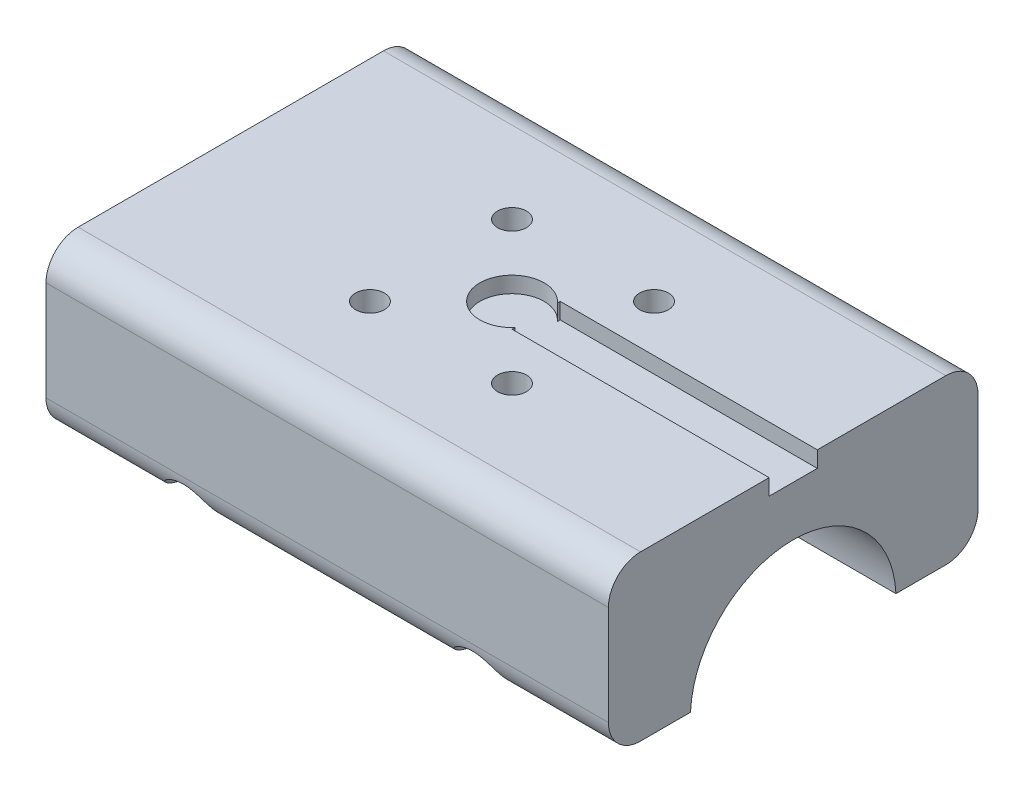
from build123d import *

# Parameters (mm, degrees)
BOSS_EXTRUDE1_DEPTH     = 35
CUT_EXTRUDE1_DEPTH      = 47.8508271
CUT_EXTRUDE1_DEPTH_BACK = 47.8508271
SKETCH2_R               = 12.8
SKETCH3_R               = 2
CUT_EXTRUDE2_DEPTH      = 7.5
SKETCH4_R               = 3.75
CUT_EXTRUDE3_DEPTH      = 16.5
SKETCH5_R               = 1.8
CUT_EXTRUDE4_DEPTH      = 22
SKETCH6_R               = 4
CUT_EXTRUDE5_DEPTH      = 2
SKETCH7_W               = 32
SKETCH7_H               = 6
CUT_EXTRUDE6_DEPTH      = 2
CUT_EXTRUDE7_DEPTH      = 47.850827224
CUT_EXTRUDE7_DEPTH_BACK = 47.850827224
SKETCH8_R               = 1.8
SKETCH9_R               = 3.75
CUT_EXTRUDE8_DEPTH      = 5
CUT_EXTRUDE9_DEPTH      = 8


with BuildPart() as part:
    # Sketch1 → Boss-Extrude1 (new, symmetric)
    with BuildSketch(Plane(origin=(0, 0, 0), x_dir=(0, 0, -1), z_dir=(1, 0, 0))):
        with BuildLine():
            Line((-19, 0.6), (19, 0.6))
            ThreePointArc((19, 0.6), (21.828427125, 1.771572875), (23, 4.6))
            Line((23, 4.6), (23, 17))
            ThreePointArc((23, 17), (21.828427125, 19.828427125), (19, 21))
            Line((19, 21), (-19, 21))
            ThreePointArc((-19, 21), (-21.828427125, 19.828427125), (-23, 17))
            Line((-23, 17), (-23, 4.6))
            ThreePointArc((-23, 4.6), (-21.828427125, 1.771572875), (-19, 0.6))
        make_face()
    extrude(amount=BOSS_EXTRUDE1_DEPTH, both=True)

    # Sketch2 → Cut-Extrude1 (cut, two sides: drawn at the far end of the back side and taken through both)
    with BuildSketch(Plane(origin=(0, 0, 0), x_dir=(0, 0, -1), z_dir=(1, 0, 0)).offset(-CUT_EXTRUDE1_DEPTH_BACK)):
        Circle(SKETCH2_R)
    extrude(amount=CUT_EXTRUDE1_DEPTH + CUT_EXTRUDE1_DEPTH_BACK, mode=Mode.SUBTRACT)

    # Sketch3 → Cut-Extrude2 (cut)
    with BuildSketch(Plane(origin=(0, 0.6, 0), x_dir=(1, 0, 0), z_dir=(0, 1, 0))):
        with Locations(Location((28, -17.5, 0), (0, 0, 228.590377891))):
            Circle(SKETCH3_R)
        with Locations(Location((28, 17.5, 0), (0, 0, 48.590377891))):
            Circle(SKETCH3_R)
        with Locations(Location((-28, -17.5, 0), (0, 0, 228.590377891))):
            Circle(SKETCH3_R)
        with Locations(Location((-28, 17.5, 0), (0, 0, 48.590377891))):
            Circle(SKETCH3_R)
    extrude(amount=CUT_EXTRUDE2_DEPTH, mode=Mode.SUBTRACT)

    # Sketch4 → Cut-Extrude3 (cut)
    with BuildSketch(Plane(origin=(0, 0, 0), x_dir=(1, 0, 0), z_dir=(0, 1, 0))):
        with Locations(Location((8.84, -8.84, 0), (0, 0, 90))):
            Circle(SKETCH4_R)
        with Locations(Location((8.84, 8.84, 0), (0, 0, 90))):
            Circle(SKETCH4_R)
        with Locations(Location((-8.84, -8.84, 0), (0, 0, 90))):
            Circle(SKETCH4_R)
        with Locations(Location((-8.84, 8.84, 0), (0, 0, 90))):
            Circle(SKETCH4_R)
    extrude(amount=CUT_EXTRUDE3_DEPTH, mode=Mode.SUBTRACT)

    # Sketch5 → Cut-Extrude4 (cut)
    with BuildSketch(Plane(origin=(0, 0, 0), x_dir=(1, 0, 0), z_dir=(0, 1, 0))):
        with Locations(Location((8.84, -8.84, 0), (0, 0, 90))):
            Circle(SKETCH5_R)
        with Locations(Location((8.84, 8.84, 0), (0, 0, 90))):
            Circle(SKETCH5_R)
        with Locations(Location((-8.84, -8.84, 0), (0, 0, 90))):
            Circle(SKETCH5_R)
        with Locations(Location((-8.84, 8.84, 0), (0, 0, 90))):
            Circle(SKETCH5_R)
    extrude(amount=CUT_EXTRUDE4_DEPTH, mode=Mode.SUBTRACT)

    # Sketch6 → Cut-Extrude5 (cut)
    with BuildSketch(Plane(origin=(0, 21, 0), x_dir=(1, 0, 0), z_dir=(0, 1, 0))):
        with Locations(Location((0, 0, 0), (0, 0, 270))):
            Circle(SKETCH6_R)
    extrude(amount=-CUT_EXTRUDE5_DEPTH, mode=Mode.SUBTRACT)

    # Sketch7 → Cut-Extrude6 (cut)
    with BuildSketch(Plane(origin=(0, 21, 0), x_dir=(1, 0, 0), z_dir=(0, 1, 0))):
        with Locations((19, 0)):
            Rectangle(SKETCH7_W, SKETCH7_H)
    extrude(amount=-CUT_EXTRUDE6_DEPTH, mode=Mode.SUBTRACT)

    # Sketch8 → Cut-Extrude7 (cut, two sides: drawn at the far end of the back side and taken through both)
    with BuildSketch(Plane.XY.offset(-CUT_EXTRUDE7_DEPTH_BACK)):
        with Locations((18, 0)):
            Circle(SKETCH8_R)
        with Locations((-18, 0)):
            Circle(SKETCH8_R)
    extrude(amount=CUT_EXTRUDE7_DEPTH + CUT_EXTRUDE7_DEPTH_BACK, mode=Mode.SUBTRACT)

    # Sketch9 → Cut-Extrude8 (cut)
    with BuildSketch(Plane.XY.offset(23)):
        with Locations((18, 0)):
            Circle(SKETCH9_R)
        with Locations((-18, 0)):
            Circle(SKETCH9_R)
    extrude(amount=-CUT_EXTRUDE8_DEPTH, mode=Mode.SUBTRACT)

    # Sketch10 → Cut-Extrude9 (cut)
    with BuildSketch(Plane.XY.offset(-23)):
        Polygon((20.85, 1.645448267), (18, 3.290896534), (15.15, 1.645448267), (15.15, -1.645448267), (18, -3.290896534), (20.85, -1.645448267), align=None)
        Polygon((-15.15, 1.645448267), (-18, 3.290896534), (-20.85, 1.645448267), (-20.85, -1.645448267), (-18, -3.290896534), (-15.15, -1.645448267), align=None)
    extrude(amount=CUT_EXTRUDE9_DEPTH, mode=Mode.SUBTRACT)


solid = part.part
